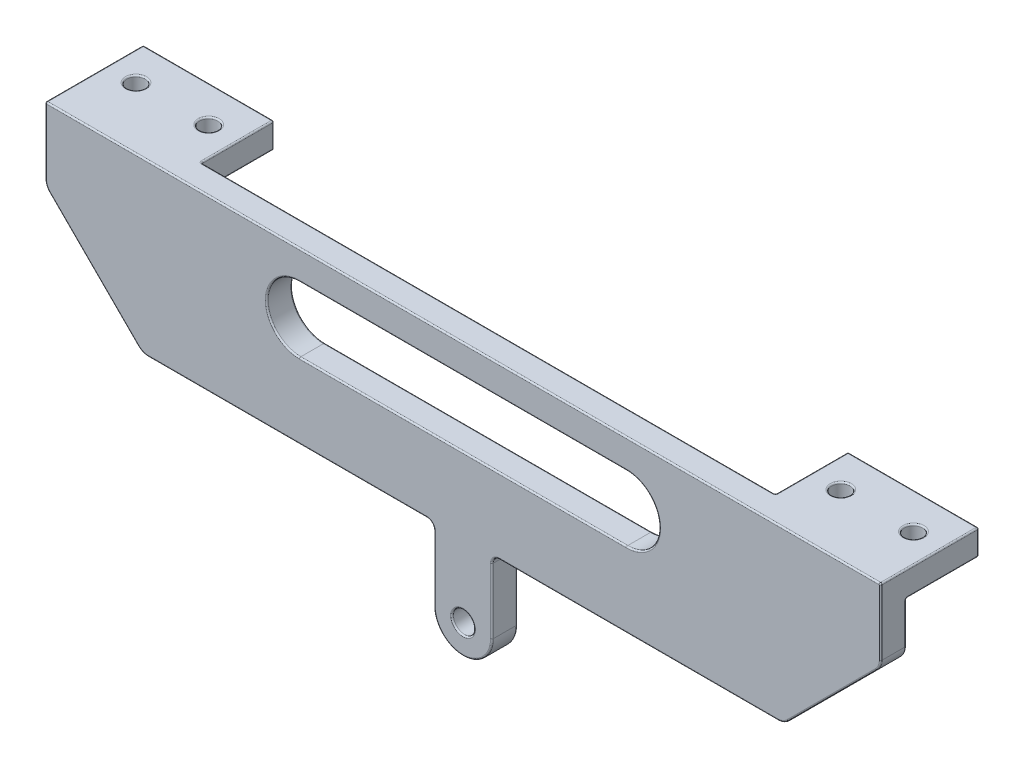
from build123d import *

# Parameters (mm, degrees)
SKETCH5_R           = 1.5
BOSS_EXTRUDE1_DEPTH = 3.5
SKETCH6_W           = 18
SKETCH6_H           = 10
SKETCH6_R           = 1.25
BOSS_EXTRUDE2_DEPTH = 3.5
FILLET1_R           = 2
FILLET2_R           = 1
FILLET5_R           = 0.2


with BuildPart() as part:
    # Sketch5 → Boss-Extrude1 (new body)
    with BuildSketch(Plane.XY):
        with BuildLine():
            Line((57.49384108, 93.35), (-57.50615892, 93.35))
            Line((-57.50615892, 93.35), (-57.50615892, 83.35))
            Line((-57.50615892, 83.35), (-44.142135624, 70))
            Line((-44.142135624, 70), (-4, 70))
            Line((-4, 70), (-4, 60))
            ThreePointArc((-4, 60), (0, 56), (4, 60))
            Line((4, 60), (4, 70))
            Line((4, 70), (44.142135624, 70))
            Line((44.142135624, 70), (57.49384108, 83.35))
            Line((57.49384108, 83.35), (57.49384108, 93.35))
        make_face()
        with Locations((0, 60)):
            Circle(SKETCH5_R, mode=Mode.SUBTRACT)
        with BuildLine():
            Line((22.5, 89.35), (-22.5, 89.35))
            ThreePointArc((-22.5, 89.35), (-27, 84.85), (-22.5, 80.35))
            Line((-22.5, 80.35), (22.5, 80.35))
            ThreePointArc((22.5, 80.35), (27, 84.85), (22.5, 89.35))
        make_face(mode=Mode.SUBTRACT)
    extrude(amount=BOSS_EXTRUDE1_DEPTH)

    # Sketch6 → Boss-Extrude2 (add)
    # profile 1 of 2: a face of its own
    with BuildSketch(Plane(origin=(0, 93.35, 0), x_dir=(1, 0, 0), z_dir=(0, 1, 0))):
        with Locations((-48.50615892, 5)):
            Rectangle(SKETCH6_W, SKETCH6_H)
        with Locations(Location((-53.50615892, 5, 0), (0, 0, 270))):
            Circle(SKETCH6_R, mode=Mode.SUBTRACT)
        with Locations(Location((-43.50615892, 5, 0), (0, 0, 270))):
            Circle(SKETCH6_R, mode=Mode.SUBTRACT)
    # profile 2 of 2: a face of its own
    with BuildSketch(Plane(origin=(0, 93.35, 0), x_dir=(1, 0, 0), z_dir=(0, 1, 0))):
        with Locations((48.49384108, 5)):
            Rectangle(SKETCH6_W, SKETCH6_H)
        with Locations(Location((43.49384108, 5, 0), (0, 0, 270))):
            Circle(SKETCH6_R, mode=Mode.SUBTRACT)
        with Locations(Location((53.49384108, 5, 0), (0, 0, 270))):
            Circle(SKETCH6_R, mode=Mode.SUBTRACT)
    extrude(amount=-BOSS_EXTRUDE2_DEPTH)

    # Fillet1
    fillet1_edges = [part.edges().sort_by_distance(p)[0] for p in [
        (57.49384108, 83.35, 1.75),
        (44.142135624, 70, 1.75),
        (-44.142135624, 70, 1.75),
        (-57.50615892, 83.35, 1.75),
    ]]
    fillet(fillet1_edges, radius=FILLET1_R)

    # Fillet2
    fillet2_edges = [part.edges().sort_by_distance(p)[0] for p in [
        (4, 70, 1.75),
        (-4, 70, 1.75),
    ]]
    fillet(fillet2_edges, radius=FILLET2_R)

    # Fillet5
    fillet5_edges = [part.edges().sort_by_distance(p)[0] for p in [
        (24.156891664, 70, 0),
        (24.156891664, 70, 3.5),
        (-4, 64.5, 0),
        (-4, 64.5, 3.5),
        (4.292893219, 69.707106781, 0),
        (4.292893219, 69.707106781, 3.5),
        (-4.292893219, 69.707106781, 0),
        (-4.292893219, 69.707106781, 3.5),
        (4, 64.5, 0),
        (0, 56, 0),
        (-57.50615892, 93.35, -3.25),
        (57.49384108, 93.35, -3.25),
        (0, 56, 3.5),
        (4, 64.5, 3.5),
        (-1.5, 60, 0),
        (-1.5, 60, 3.5),
        (-27, 84.85, 0),
        (0, 80.35, 0),
        (27, 84.85, 0),
        (0, 89.35, 0),
        (-27, 84.85, 3.5),
        (0, 80.35, 3.5),
        (27, 84.85, 3.5),
        (0, 89.35, 3.5),
        (-0.00615892, 93.35, 3.5),
        (-57.50615892, 87.014521099, 0),
        (-57.50615892, 89.85, -5),
        (-48.50615892, 89.85, -10),
        (-57.50615892, 88.764521099, 3.5),
        (-57.50615892, 91.6, -10),
        (-39.50615892, 89.85, -5),
        (-39.50615892, 91.6, -10),
        (-48.50615892, 89.85, 0),
        (-39.50615892, 91.6, 0),
        (-43.50615892, 89.85, -6.25),
        (-53.50615892, 89.85, -6.25),
        (-39.50615892, 93.35, -5),
        (-48.50615892, 93.35, -10),
        (-53.50615892, 93.35, -6.25),
        (-43.50615892, 93.35, -6.25),
        (-0.00615892, 93.35, 0),
        (57.49384108, 89.85, -5),
        (57.49384108, 91.6, -10),
        (48.49384108, 89.85, 0),
        (39.49384108, 89.85, -5),
        (39.49384108, 91.6, 0),
        (48.49384108, 89.85, -10),
        (39.49384108, 91.6, -10),
        (53.49384108, 89.85, -6.25),
        (43.49384108, 89.85, -6.25),
        (48.49384108, 93.35, -10),
        (39.49384108, 93.35, -5),
        (43.49384108, 93.35, -6.25),
        (53.49384108, 93.35, -6.25),
        (57.49384108, 87.014250977, 0),
        (57.49384108, 88.764250977, 3.5),
        (50.817935436, 76.674947091, 0),
        (-24.15716172, 70, 0),
        (-50.823712168, 76.674565353, 0),
        (-57.353717035, 83.413190378, 0),
        (-44.079205295, 70.152040112, 0),
        (44.079091183, 70.152216494, 0),
        (57.341575702, 83.413076082, 0),
        (50.817935436, 76.674947091, 3.5),
        (-50.823712168, 76.674565353, 3.5),
        (-24.15716172, 70, 3.5),
        (-57.353717035, 83.413190378, 3.5),
        (-44.079205295, 70.152040112, 3.5),
        (44.079091183, 70.152216494, 3.5),
        (57.341575702, 83.413076082, 3.5),
    ]]
    fillet(fillet5_edges, radius=FILLET5_R)


solid = part.part
